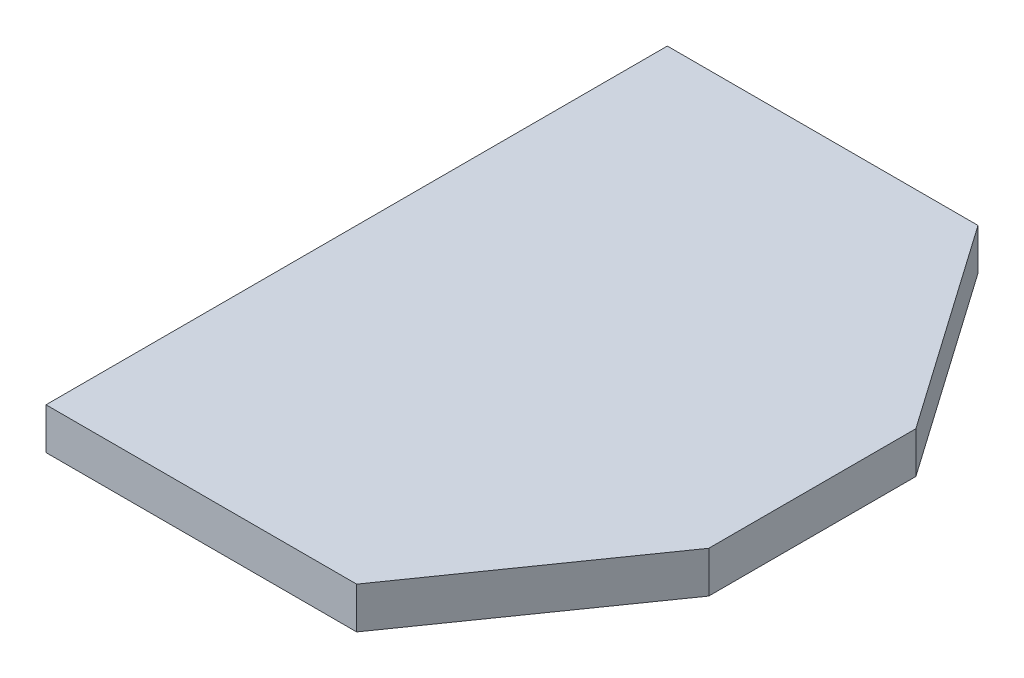
from build123d import *

# Parameters (mm, degrees)
BOSS_EXTRUDE1_DEPTH = 5


with BuildPart() as part:
    # Sketch1 → Boss-Extrude1 (new, symmetric)
    with BuildSketch(Plane(origin=(0, 0, 0), x_dir=(1, 0, 0), z_dir=(0, 1, 0))):
        Polygon((29, -25), (104, -25), (139, 25), (139, 75), (104, 125), (29, 125), align=None)
    extrude(amount=BOSS_EXTRUDE1_DEPTH, both=True)


solid = part.part
